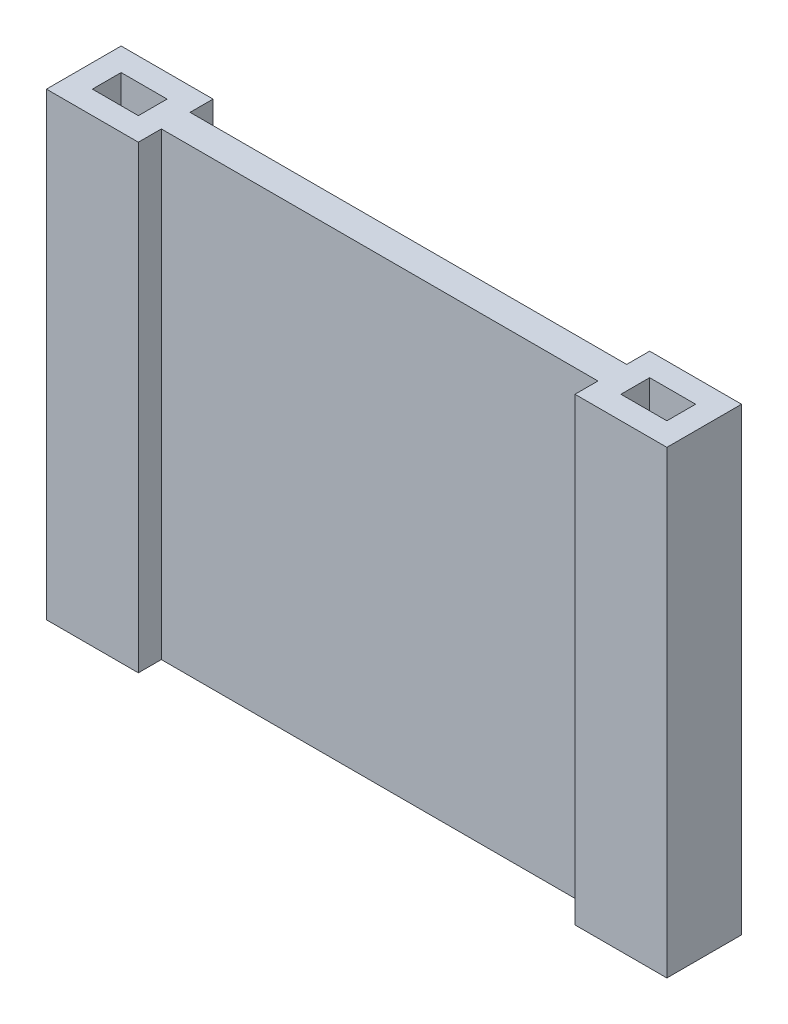
from build123d import *

# Parameters (mm, degrees)
SKETCH_1_W      = 80
SKETCH_1_H      = 80
EXTRUDE_1_DEPTH = 5
SKETCH_2_W      = 4
SKETCH_2_H      = 80
EXTRUDE_2_DEPTH = 4
SKETCH_2_2_W    = 4
SKETCH_2_2_H    = 80
EXTRUDE_3_DEPTH = 12
SKETCH_3_W      = 4
SKETCH_3_H      = 80
EXTRUDE_4_DEPTH = 9
SKETCH_6_W      = 8
SKETCH_6_H      = 5
EXTRUDE_5_DEPTH = 80


with BuildPart() as part:
    # 草图1 → 凸台-拉伸1 (new body)
    with BuildSketch(Plane.XY):
        with Locations((40, -40)):
            Rectangle(SKETCH_1_W, SKETCH_1_H)
    extrude(amount=EXTRUDE_1_DEPTH)

    # 草图2 → 凸台-拉伸2 (add)
    with BuildSketch(Plane(origin=(80, 0, 0), x_dir=(0, 0, -1), z_dir=(1, 0, 0))):
        with Locations((-7, -40)):
            Rectangle(SKETCH_2_W, SKETCH_2_H)
        with Locations((2, -40)):
            Rectangle(SKETCH_2_W, SKETCH_2_H)
    extrude(amount=-EXTRUDE_2_DEPTH)

    # 草图2<2> → 凸台-拉伸3 (add)
    with BuildSketch(Plane(origin=(80, 0, 0), x_dir=(0, 0, -1), z_dir=(1, 0, 0))):
        with Locations((-7, -40)):
            Rectangle(SKETCH_2_2_W, SKETCH_2_2_H)
        with Locations((2, -40)):
            Rectangle(SKETCH_2_2_W, SKETCH_2_2_H)
    extrude(amount=EXTRUDE_3_DEPTH)

    # 草图3 → 凸台-拉伸4 (add)
    with BuildSketch(Plane.XY.offset(9)):
        with Locations((90, -40)):
            Rectangle(SKETCH_3_W, SKETCH_3_H)
    extrude(amount=-EXTRUDE_4_DEPTH)

    # 草图6 → 凸台-拉伸5 (add)
    with BuildSketch(Plane.XZ.offset(80)):
        Polygon((-16, -4), (0, -4), (0, 0), (0, 5), (0, 9), (-16, 9), align=None)
        with Locations((-8, 2.5)):
            Rectangle(SKETCH_6_W, SKETCH_6_H, mode=Mode.SUBTRACT)
    extrude(amount=-EXTRUDE_5_DEPTH)


solid = part.part
